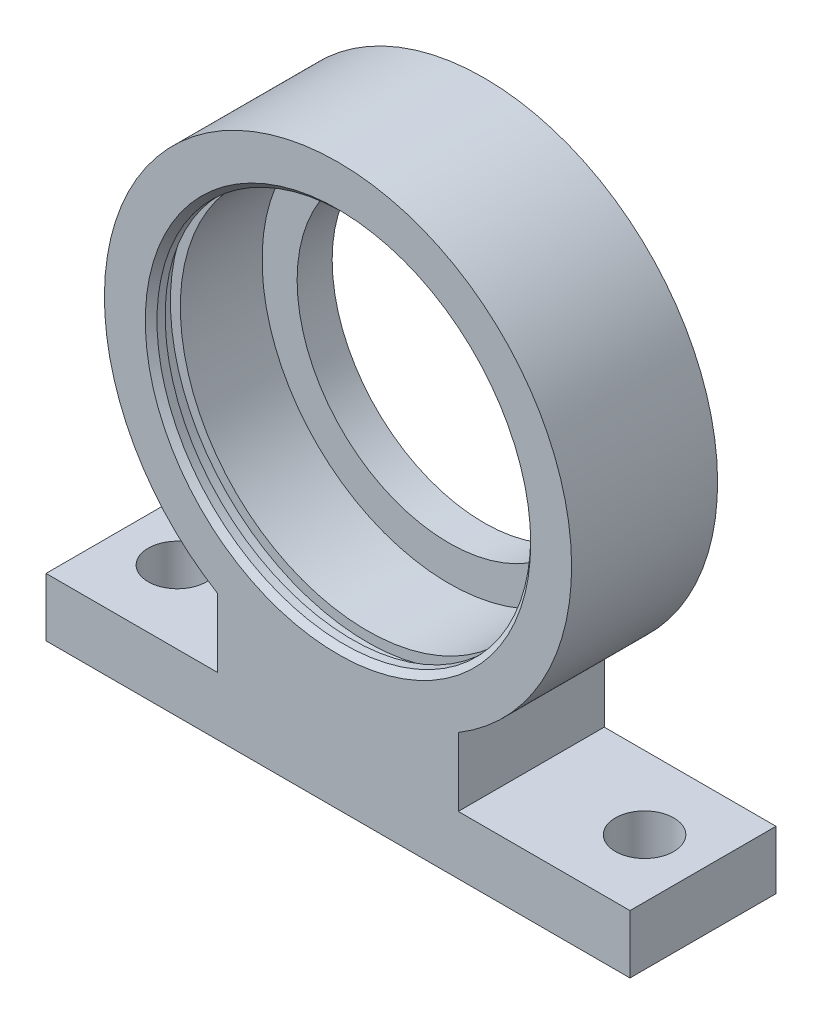
from build123d import *

# Parameters (mm, degrees)
SKETCH1_R           = 13
BOSS_EXTRUDE1_DEPTH = 12.5
CUT_EXTRUDE1_START  = 3
SKETCH2_R           = 16
CUT_EXTRUDE1_DEPTH  = 37.563240514
SKETCH3_R           = 2.5
CUT_EXTRUDE2_DEPTH  = 52.285962992
CUT_EXTRUDE3_START  = 10
SKETCH5_R           = 16.85
SKETCH5_R_2         = 16
CUT_EXTRUDE3_DEPTH  = 1.3
CHAMFER2_SIZE       = 0.5


with BuildPart() as part:
    # Sketch1 → Boss-Extrude1 (new body)
    with BuildSketch(Plane.XY):
        with BuildLine():
            Line((25, -28), (-25, -28))
            Line((-25, -28), (-25, -23))
            Line((-25, -23), (-10.297842021, -23))
            Line((-10.297842021, -23), (-10.297842021, -17.145099875))
            ThreePointArc((-10.297842021, -17.145099875), (0, 20), (10.297842021, -17.145099875))
            Line((10.297842021, -17.145099875), (10.297842021, -23))
            Line((10.297842021, -23), (25, -23))
            Line((25, -23), (25, -28))
        make_face()
        Circle(SKETCH1_R, mode=Mode.SUBTRACT)
    extrude(amount=BOSS_EXTRUDE1_DEPTH)

    # Sketch2 → Cut-Extrude1 (cut, through all)
    with BuildSketch(Plane.XY.offset(CUT_EXTRUDE1_START)):
        Circle(SKETCH2_R)
    extrude(amount=CUT_EXTRUDE1_DEPTH, mode=Mode.SUBTRACT)

    # Sketch3 → Cut-Extrude2 (cut, through all)
    with BuildSketch(Plane(origin=(0, -23, 0), x_dir=(1, 0, 0), z_dir=(0, 1, 0))):
        with Locations(Location((-20, -6.25, 0), (0, 0, 180))):
            Circle(SKETCH3_R)
        with Locations(Location((20, -6.25, 0), (0, 0, 180))):
            Circle(SKETCH3_R)
    extrude(amount=-CUT_EXTRUDE2_DEPTH, mode=Mode.SUBTRACT)

    # Sketch5 → Cut-Extrude3 (cut)
    with BuildSketch(Plane.XY.offset(CUT_EXTRUDE3_START)):
        Circle(SKETCH5_R)
        Circle(SKETCH5_R_2, mode=Mode.SUBTRACT)
    extrude(amount=CUT_EXTRUDE3_DEPTH, mode=Mode.SUBTRACT)

    # Chamfer2
    chamfer2_edges = [part.edges().sort_by_distance(p)[0] for p in [
        (-16, 0, 12.5),
    ]]
    chamfer(chamfer2_edges, length=CHAMFER2_SIZE)


solid = part.part
